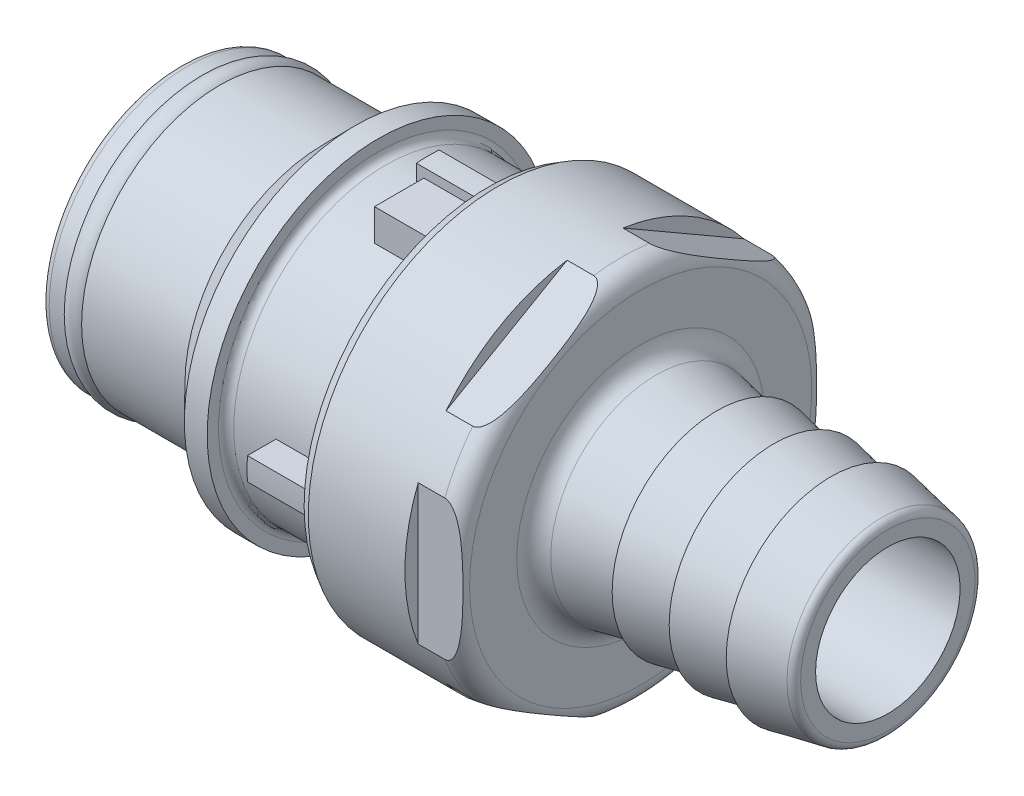
from build123d import *

# Parameters (mm, degrees)
BOSS_EXTRUDE1_DEPTH = 4.064
BOSS_EXTRUDE2_DEPTH = 4.064
BOSS_EXTRUDE3_DEPTH = 3.556
BOSS_EXTRUDE4_DEPTH = 4.064
BOSS_EXTRUDE5_DEPTH = 4.064
SKETCH10_W          = 51.409782041
SKETCH10_H          = 54.244880316
CUT_EXTRUDE1_DEPTH  = 10


with BuildPart() as part:
    # Sketch1 → Revolve1 (revolve)
    with BuildSketch(Plane(origin=(0, 0, 0), x_dir=(-1, 0, 0), z_dir=(0, 0, -1)), mode=Mode.PRIVATE) as revolve1_sk:
        with BuildLine():
            ThreePointArc((19.6723, 8.7884), (20.5613, 8.146818799), (21.4503, 8.7884))
            ThreePointArc((21.4503, 8.7884), (20.5613, 9.435118303), (19.6723, 8.7884))
        make_face()
    revolve(revolve1_sk.sketch.rotate(Axis((-21.4503, 0, 0), (1, 0, 0)), 270), axis=Axis((-21.4503, 0, 0), (1, 0, 0)))

    # Sketch2 → Revolve2 (revolve)
    with BuildSketch(Plane(origin=(0, 0, 0), x_dir=(-1, 0, 0), z_dir=(0, 0, -1)), mode=Mode.PRIVATE) as revolve2_sk:
        with BuildLine():
            Line((0, 8.382), (9.558, 8.382))
            Line((9.558, 8.382), (9.558, 7.361434934))
            Line((9.558, 7.361434934), (11.765223515, 7.361434934))
            Line((11.765223515, 7.361434934), (12.202528779, 6.604))
            Line((12.202528779, 6.604), (22.6568, 6.604))
            Line((22.6568, 6.604), (22.6568, 8.7249))
            ThreePointArc((22.6568, 8.7249), (22.508010245, 9.084110245), (22.1488, 9.2329))
            Line((22.1488, 9.2329), (13.081, 9.2329))
            Line((13.081, 9.2329), (10.922, 11.43))
            Line((10.922, 11.43), (9.398, 11.43))
            Line((9.398, 11.43), (9.398, 10.668))
            ThreePointArc((9.398, 10.668), (9.249210245, 10.308789755), (8.89, 10.16))
            Line((8.89, 10.16), (3.302, 10.16))
            ThreePointArc((3.302, 10.16), (2.403974388, 10.531974388), (2.032, 11.43))
            Line((2.032, 11.43), (2.032, 12.318717882))
            Line((2.032, 12.318717882), (1.3716, 12.7))
            Line((1.3716, 12.7), (0, 12.7))
            Line((0, 12.7), (0, 8.382))
        make_face()
    revolve(revolve2_sk.sketch.rotate(Axis((-22.6818, 0, 0), (1, 0, 0)), 270), axis=Axis((-22.6818, 0, 0), (1, 0, 0)))

    # Sketch3 → Revolve3 (revolve)
    with BuildSketch(Plane.XY, mode=Mode.PRIVATE) as revolve3_sk:
        with BuildLine():
            Line((-25.4, 0), (-25.4, 2.159))
            Line((-25.4, 2.159), (-23.749, 2.159))
            ThreePointArc((-23.749, 2.159), (-22.312159021, 2.754159021), (-21.717, 4.191))
            Line((-21.717, 4.191), (-21.717, 4.572))
            ThreePointArc((-21.717, 4.572), (-21.605407684, 4.841407684), (-21.336, 4.953))
            Line((-21.336, 4.953), (-21.209, 4.953))
            Line((-21.209, 4.953), (-21.209, 3.8862))
            ThreePointArc((-21.209, 3.8862), (-21.060210245, 3.526989755), (-20.701, 3.3782))
            Line((-20.701, 3.3782), (-18.923, 3.3782))
            ThreePointArc((-18.923, 3.3782), (-18.563789755, 3.526989755), (-18.415, 3.8862))
            Line((-18.415, 3.8862), (-18.415, 5.6896))
            Line((-18.415, 5.6896), (-16.7132, 7.3914))
            Line((-16.7132, 7.3914), (-10.668, 7.3914))
            Line((-10.668, 7.3914), (-9.906, 8.1534))
            Line((-9.906, 8.1534), (0.253999123, 8.1534))
            Line((0.253999123, 8.1534), (0.253999123, 7.747000064))
            Line((0.253999123, 7.747000064), (-0.508000877, 6.985000064))
            Line((-0.508000877, 6.985000064), (-9.144346359, 6.985000064))
            Line((-9.144346359, 6.985000064), (-9.143999577, 5.715000064))
            Line((-9.143999577, 5.715000064), (-12.445999577, 5.715000064))
            Line((-12.445999577, 5.715000064), (-14.600186171, 4.206622434))
            ThreePointArc((-14.600186171, 4.206622434), (-15.122449968, 2.945766162), (-14.200444328, 1.93957353))
            Line((-14.200444328, 1.93957353), (-9.708779561, 0.736035491))
            ThreePointArc((-9.708779561, 0.736035491), (-9.301464433, 0.463876212), (-9.143999687, 0))
            Line((-9.143999687, 0), (-25.4, 0))
        make_face()
    revolve(revolve3_sk.sketch.rotate(Axis((-9.143999687, 0, 0), (-1, 0, 0)), 180), axis=Axis((-9.143999687, 0, 0), (-1, 0, 0)))

    # Sketch4 → Boss-Extrude1 (add)
    with BuildSketch(Plane.ZY.offset(2.032)):
        with BuildLine():
            Line((-0.762, -10.131384703), (-0.762, -12.040912798))
            ThreePointArc((-0.762, -12.040912798), (0, -12.065), (0.762, -12.040912798))
            Line((0.762, -12.040912798), (0.762, -10.131384703))
            ThreePointArc((0.762, -10.131384703), (0, -10.16), (-0.762, -10.131384703))
        make_face()
    extrude(amount=BOSS_EXTRUDE1_DEPTH)

    # Sketch5 → Boss-Extrude2 (add)
    with BuildSketch(Plane.ZY.offset(2.032)):
        with BuildLine():
            Line((-12.040912798, -0.762), (-10.131384703, -0.762))
            ThreePointArc((-10.131384703, -0.762), (-10.16, 0), (-10.131384703, 0.762))
            Line((-10.131384703, 0.762), (-12.040912798, 0.762))
            ThreePointArc((-12.040912798, 0.762), (-12.065, 0), (-12.040912798, -0.762))
        make_face()
    extrude(amount=BOSS_EXTRUDE2_DEPTH)

    # Sketch6 → Boss-Extrude3 (add)
    with BuildSketch(Plane.ZY.offset(2.032)):
        with BuildLine():
            Line((4.064, 9.311793812), (4.064, 11.43))
            Line((4.064, 11.43), (0.762, 11.43))
            Line((0.762, 11.43), (0.762, 12.040912798))
            ThreePointArc((0.762, 12.040912798), (0, 12.065), (-0.762, 12.040912798))
            Line((-0.762, 12.040912798), (-0.762, 10.131384703))
            ThreePointArc((-0.762, 10.131384703), (1.701097677, 10.016579591), (4.064, 9.311793812))
        make_face()
    extrude(amount=BOSS_EXTRUDE3_DEPTH)

    # Sketch7 → Boss-Extrude4 (add)
    with BuildSketch(Plane.ZY.offset(2.032)):
        with BuildLine():
            Line((0.762, 10.131384703), (0.762, 12.040912798))
            ThreePointArc((0.762, 12.040912798), (0, 12.065), (-0.762, 12.040912798))
            Line((-0.762, 12.040912798), (-0.762, 10.131384703))
            ThreePointArc((-0.762, 10.131384703), (0, 10.16), (0.762, 10.131384703))
        make_face()
    extrude(amount=BOSS_EXTRUDE4_DEPTH)

    # Sketch8 → Boss-Extrude5 (add)
    with BuildSketch(Plane.ZY.offset(2.032)):
        with BuildLine():
            Line((10.131384703, -0.762), (12.040912798, -0.762))
            ThreePointArc((12.040912798, -0.762), (12.065, 0), (12.040912798, 0.762))
            Line((12.040912798, 0.762), (10.131384703, 0.762))
            ThreePointArc((10.131384703, 0.762), (10.16, 0), (10.131384703, -0.762))
        make_face()
    extrude(amount=BOSS_EXTRUDE5_DEPTH)

    # Sketch9 → Revolve4 (revolve)
    with BuildSketch(Plane.XZ):
        with BuildLine():
            Line((5.715, 4.826), (24.638, 4.826))
            Line((24.638, 4.826), (24.638, 5.824634406))
            ThreePointArc((24.638, 5.824634406), (24.522031713, 6.147705816), (24.227074267, 6.32327314))
            Line((24.227074267, 6.32327314), (20.828, 6.985))
            Line((20.828, 6.985), (20.828, 6.7056))
            ThreePointArc((20.828, 6.7056), (20.689303558, 6.411576215), (20.3741943, 6.33162095))
            Line((20.3741943, 6.33162095), (17.018, 6.985))
            Line((17.018, 6.985), (17.018, 6.7056))
            ThreePointArc((17.018, 6.7056), (16.879303558, 6.411576215), (16.5641943, 6.33162095))
            Line((16.5641943, 6.33162095), (13.208, 6.985))
            Line((13.208, 6.985), (13.208, 6.7056))
            ThreePointArc((13.208, 6.7056), (13.069303558, 6.411576215), (12.7541943, 6.33162095))
            Line((12.7541943, 6.33162095), (9.155314332, 7.032245695))
            ThreePointArc((9.155314332, 7.032245695), (8.417920718, 7.471164003), (8.128, 8.278842529))
            Line((8.128, 8.278842529), (8.128, 11.43))
            ThreePointArc((8.128, 11.43), (7.756025612, 12.328025612), (6.858, 12.7))
            Line((6.858, 12.7), (0, 12.7))
            Line((0, 12.7), (0, 8.382))
            Line((0, 8.382), (3.302, 8.382))
            Line((3.302, 8.382), (3.302, 7.5565))
            ThreePointArc((3.302, 7.5565), (3.413592316, 7.287092316), (3.683, 7.1755))
            Line((3.683, 7.1755), (5.207, 7.1755))
            ThreePointArc((5.207, 7.1755), (5.566210245, 7.026710245), (5.715, 6.6675))
            Line((5.715, 6.6675), (5.715, 4.826))
        make_face()
    revolve(axis=Axis((24.663000006, 0, 0), (-1, 0, 0)))

    # Sketch10 → Cut-Extrude1 (cut)
    with BuildSketch(Plane(origin=(5.08, 0, 0), x_dir=(0, 0, -1), z_dir=(1, 0, 0))):
        with Locations((0.708774568, -0.89778112)):
            Rectangle(SKETCH10_W, SKETCH10_H)
        Polygon((-11.811, 6.819084029), (-11.811, -6.819084029), (0, -13.638168059), (11.811, -6.819084029), (11.811, 6.819084029), (0, 13.638168059), align=None, mode=Mode.SUBTRACT)
    extrude(amount=CUT_EXTRUDE1_DEPTH, mode=Mode.SUBTRACT)


solid = part.part
